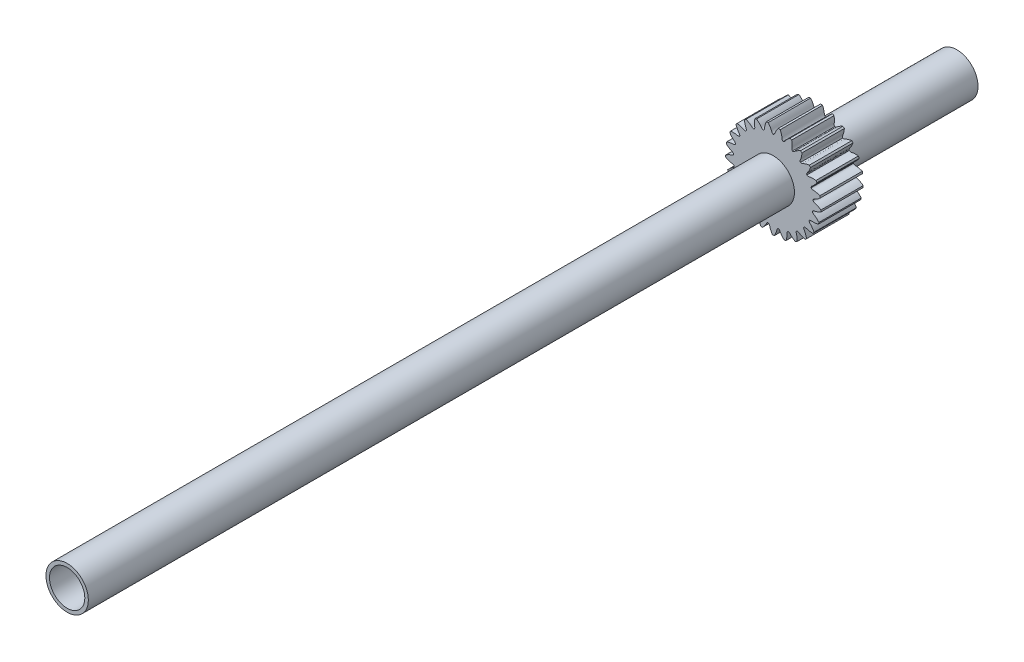
from build123d import *

# Parameters (mm, degrees)
SKETCH_1_R               = 33.75
EXTRUDE_1_DEPTH          = 30
CUT_EXTRUDE_1_DEPTH      = 57.374861419
PATTERN_CIRCULAR_1_COUNT = 25
SKETCH_4_R               = 12.5
CUT_EXTRUDE_2_DEPTH      = 30
SKETCH_5_R               = 15
SKETCH_5_R_2             = 12.5
EXTRUDE_2_DEPTH          = 500
SKETCH_6_R               = 15
SKETCH_6_R_2             = 12.5
EXTRUDE_3_DEPTH          = 100


with BuildPart() as part:
    # 草图1 → 凸台-拉伸1 (new body)
    with BuildSketch(Plane.XY):
        Circle(SKETCH_1_R)
    extrude(amount=EXTRUDE_1_DEPTH)

    # 草图2 → 切除-拉伸1 (cut, through all)
    with BuildSketch(Plane.XY):
        with BuildLine():
            ThreePointArc((0.006292204, 28.124999296), (0, 28.125), (-0.006292204, 28.124999296))
            add(Edge.make_bspline(
                [(-0.006292204, 28.124999296), (-0.904267779, 28.422267441), (-1.075989668, 29.181414129), (-1.380213993, 29.960685373), (-1.457514668, 30.148215368), (-1.543137001, 30.344517162), (-1.637383171, 30.549369823), (-1.740650112, 30.762490906), (-1.853297738, 30.983600909), (-1.975686713, 31.212404845), (-2.108167153, 31.448597816), (-2.251081493, 31.691863673), (-2.40476328, 31.94187568), (-2.569537148, 32.198296602), (-2.745718452, 32.460778975), (-2.933613018, 32.728965336), (-3.13351686, 33.002488461), (-3.345715917, 33.280971625), (-3.57048579, 33.564028851), (-3.808091489, 33.851265182), (-4.058787183, 34.142276945), (-4.322815961, 34.436652032), (-4.600409598, 34.733970183), (-4.891788323, 35.033803272), (-5.197160604, 35.335715607), (-5.516722929, 35.639264225), (-5.850659607, 35.943999201), (-6.19914256, 36.249463961), (-6.562331143, 36.555195593), (-6.940371948, 36.860725177), (-7.333398656, 37.165578101), (-7.74153177, 37.469274402), (-8.312142923, 37.876400804), (-8.753937419, 38.171827697), (-9.055382067, 38.364974496)],
                knots=[0, 0, 0, 0, 0.152600669, 0.166414695, 0.181045959, 0.196494463, 0.212760206, 0.229843187, 0.247743407, 0.266460867, 0.285995565, 0.306347502, 0.327516678, 0.349503093, 0.372306747, 0.39592764, 0.420365772, 0.445621143, 0.471693752, 0.498583601, 0.526290688, 0.554815015, 0.58415658, 0.614315384, 0.645291427, 0.67708471, 0.709695231, 0.743122991, 0.777367989, 0.812430227, 0.848309704, 0.88500642, 0.922520374, 1, 1, 1, 1], degree=3))
            ThreePointArc((-9.055382067, 38.364974496), (0, 39.419173158), (9.055382067, 38.364974496))
            add(Edge.make_bspline(
                [(0.006292204, 28.124999296), (0.904267779, 28.422267441), (1.075989668, 29.181414129), (1.380213993, 29.960685373), (1.457514668, 30.148215368), (1.543137001, 30.344517162), (1.637383171, 30.549369823), (1.740650112, 30.762490906), (1.853297738, 30.983600909), (1.975686713, 31.212404845), (2.108167153, 31.448597816), (2.251081493, 31.691863673), (2.40476328, 31.94187568), (2.569537148, 32.198296602), (2.745718452, 32.460778975), (2.933613018, 32.728965336), (3.13351686, 33.002488461), (3.345715917, 33.280971625), (3.57048579, 33.564028851), (3.808091489, 33.851265182), (4.058787183, 34.142276945), (4.322815961, 34.436652032), (4.600409598, 34.733970183), (4.891788323, 35.033803272), (5.197160604, 35.335715607), (5.516722929, 35.639264225), (5.850659607, 35.943999201), (6.19914256, 36.249463961), (6.562331143, 36.555195593), (6.940371948, 36.860725177), (7.333398656, 37.165578101), (7.74153177, 37.469274402), (8.312142923, 37.876400804), (8.753937419, 38.171827697), (9.055382067, 38.364974496)],
                knots=[0, 0, 0, 0, 0.152600669, 0.166414695, 0.181045959, 0.196494463, 0.212760206, 0.229843187, 0.247743407, 0.266460867, 0.285995565, 0.306347502, 0.327516678, 0.349503093, 0.372306747, 0.39592764, 0.420365772, 0.445621143, 0.471693752, 0.498583601, 0.526290688, 0.554815015, 0.58415658, 0.614315384, 0.645291427, 0.67708471, 0.709695231, 0.743122991, 0.777367989, 0.812430227, 0.848309704, 0.88500642, 0.922520374, 1, 1, 1, 1], degree=3))
        make_face()
    cut_extrude_1 = extrude(amount=CUT_EXTRUDE_1_DEPTH, mode=Mode.SUBTRACT)

    # 阵列(圆周)1: 切除-拉伸1 ×25 about axis
    pattern_circular_1_axis = Axis((0, 0, 30), (0, 0, -1))
    for i in range(1, PATTERN_CIRCULAR_1_COUNT):
        add(cut_extrude_1.rotate(pattern_circular_1_axis, i * 360 / PATTERN_CIRCULAR_1_COUNT), mode=Mode.SUBTRACT)

    # 草图4 → 切除-拉伸2 (cut)
    with BuildSketch(Plane(origin=(0, 0, 0), x_dir=(-1, 0, 0), z_dir=(0, 0, -1))):
        Circle(SKETCH_4_R)
    extrude(amount=-CUT_EXTRUDE_2_DEPTH, mode=Mode.SUBTRACT)


with BuildPart() as body_2:
    # 草图5 → 凸台-拉伸2 (new body)
    with BuildSketch(Plane.XY.offset(30)):
        Circle(SKETCH_5_R)
        Circle(SKETCH_5_R_2, mode=Mode.SUBTRACT)
    extrude(amount=EXTRUDE_2_DEPTH)


with BuildPart() as body_3:
    # 草图6 → 凸台-拉伸3 (new body)
    with BuildSketch(Plane(origin=(0, 0, 0), x_dir=(-1, 0, 0), z_dir=(0, 0, -1))):
        Circle(SKETCH_6_R)
        Circle(SKETCH_6_R_2, mode=Mode.SUBTRACT)
    extrude(amount=EXTRUDE_3_DEPTH)


solid = Compound([part.part, body_2.part, body_3.part])
